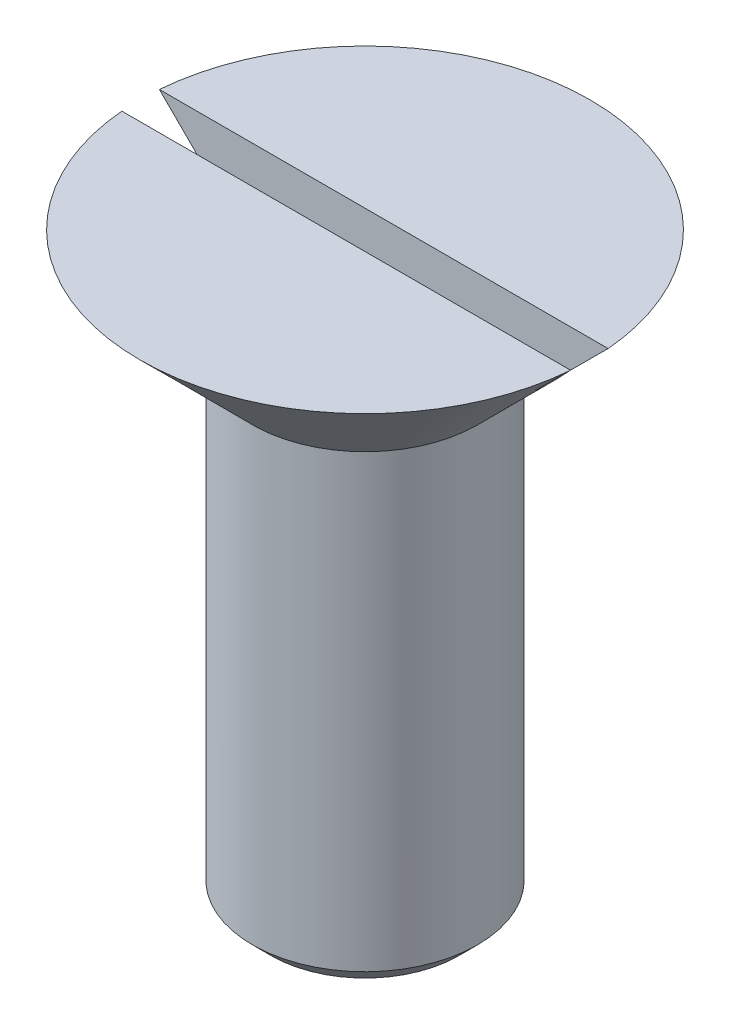
from build123d import *

# Parameters (mm, degrees)
CUT_EXTRUDE1_DEPTH      = 36.341194094
CUT_EXTRUDE1_DEPTH_BACK = 36.341194094
SKETCH3_W               = 2
SKETCH3_H               = 2
CHAMFER1_SIZE           = 1


with BuildPart() as part:
    # Sketch2 → Revolve1 (revolve)
    with BuildSketch(Plane.XY):
        Polygon((1, 31), (1, 29), (0, 29), (0, 0), (6, 0), (6, 25), (12, 31), align=None)
    revolve(axis=Axis((0, 0, 0), (0, 1, 0)))

    # Sketch3 → Cut-Extrude1 (cut, two sides: drawn at the far end of the back side and taken through both)
    with BuildSketch(Plane(origin=(0, 0, 0), x_dir=(0, 0, -1), z_dir=(1, 0, 0)).offset(-CUT_EXTRUDE1_DEPTH_BACK)):
        with Locations((0, 30)):
            Rectangle(SKETCH3_W, SKETCH3_H)
    extrude(amount=CUT_EXTRUDE1_DEPTH + CUT_EXTRUDE1_DEPTH_BACK, mode=Mode.SUBTRACT)

    # Chamfer1
    chamfer1_edges = [part.edges().sort_by_distance(p)[0] for p in [
        (-6, 0, 0),
    ]]
    chamfer(chamfer1_edges, length=CHAMFER1_SIZE)


solid = part.part
